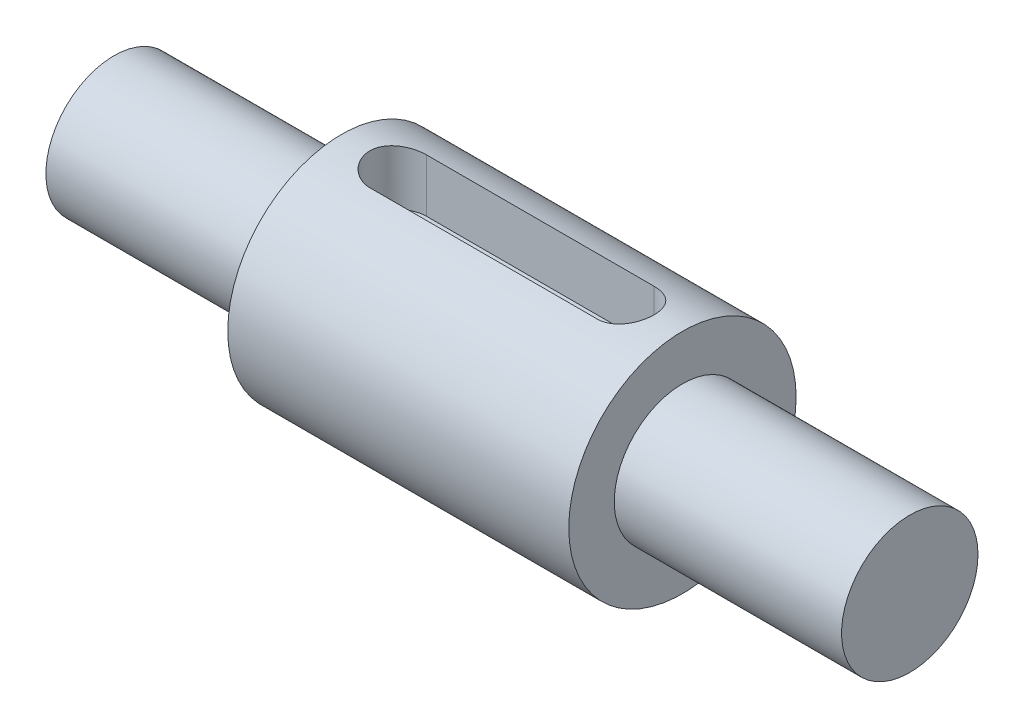
from build123d import *

# Parameters (mm, degrees)
IZIM1_R                     = 60
Y_KSEKLIK_EKSTR_ZYON1_DEPTH = 200
IZIM2_R                     = 100
Y_KSEKLIK_EKSTR_ZYON2_DEPTH = 300
IZIM3_R                     = 60
Y_KSEKLIK_EKSTR_ZYON3_DEPTH = 200
KES_EKSTR_ZYON1_DEPTH       = 200


with BuildPart() as part:
    # Çizim1 → Yükseklik-Ekstrüzyon1 (new body)
    with BuildSketch(Plane(origin=(0, 0, 0), x_dir=(0, 0, -1), z_dir=(1, 0, 0))):
        Circle(IZIM1_R)
    extrude(amount=Y_KSEKLIK_EKSTR_ZYON1_DEPTH)

    # Çizim2 → Yükseklik-Ekstrüzyon2 (add)
    with BuildSketch(Plane(origin=(200, 0, 0), x_dir=(0, 0, -1), z_dir=(1, 0, 0))):
        Circle(IZIM2_R)
    extrude(amount=Y_KSEKLIK_EKSTR_ZYON2_DEPTH)

    # Çizim3 → Yükseklik-Ekstrüzyon3 (add)
    with BuildSketch(Plane(origin=(500, 0, 0), x_dir=(0, 0, -1), z_dir=(1, 0, 0))):
        Circle(IZIM3_R)
    extrude(amount=Y_KSEKLIK_EKSTR_ZYON3_DEPTH)

    # Çizim4 → Kes-Ekstrüzyon1 (cut)
    with BuildSketch(Plane(origin=(0, 50, 0), x_dir=(1, 0, 0), z_dir=(0, 1, 0))):
        with BuildLine():
            Line((250, 25), (450, 25))
            ThreePointArc((450, 25), (475, 0), (450, -25))
            Line((450, -25), (250, -25))
            ThreePointArc((250, -25), (225, 0), (250, 25))
        make_face()
    extrude(amount=KES_EKSTR_ZYON1_DEPTH, mode=Mode.SUBTRACT)


solid = part.part
